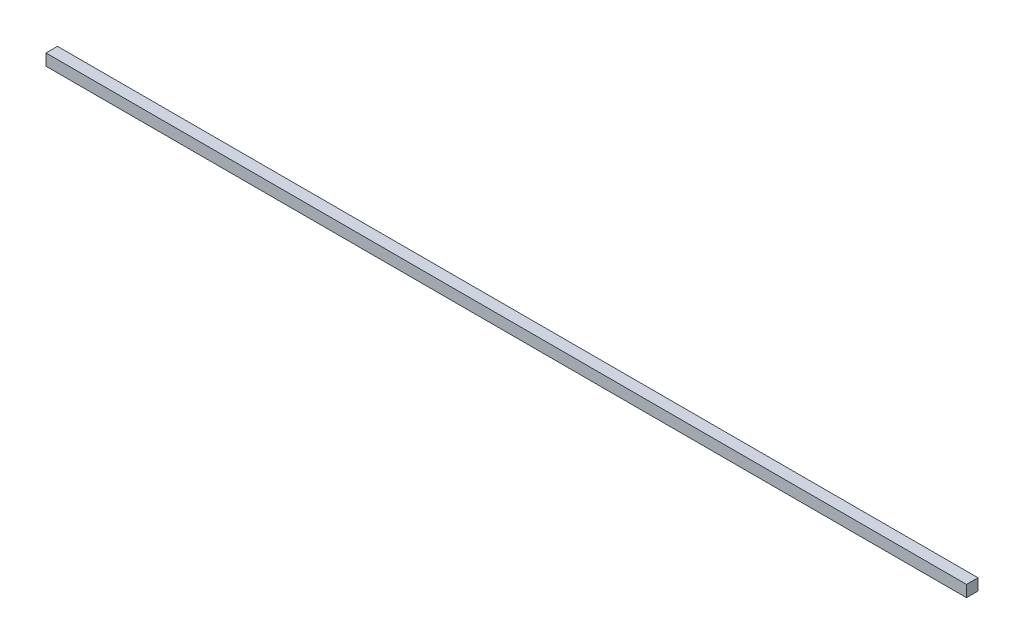
from build123d import *

# Parameters (mm, degrees)
SKETCH1_W      = 125
SKETCH1_H      = 125
EXTRUDE1_DEPTH = 10000


with BuildPart() as part:
    # Sketch1 → Extrude1 (new body)
    with BuildSketch(Plane(origin=(0, 0, 0), x_dir=(0, 0, -1), z_dir=(1, 0, 0))):
        Rectangle(SKETCH1_W, SKETCH1_H)
    extrude(amount=EXTRUDE1_DEPTH)


solid = part.part
